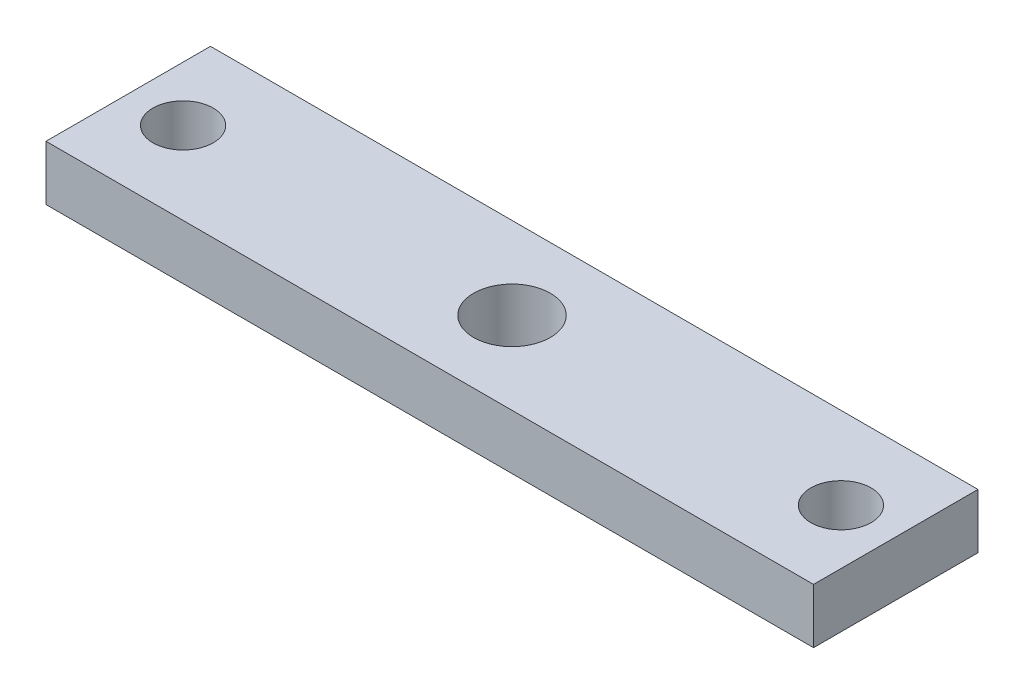
from build123d import *

# Parameters (mm, degrees)
SKETCH1_W           = 140
SKETCH1_H           = 30
BOSS_EXTRUDE1_DEPTH = 10
SKETCH2_R           = 5.5
CUT_EXTRUDE1_DEPTH  = 73.284161474


with BuildPart() as part:
    # Sketch1 → Boss-Extrude1 (new body)
    with BuildSketch(Plane(origin=(0, 0, 0), x_dir=(1, 0, 0), z_dir=(0, 1, 0))):
        Rectangle(SKETCH1_W, SKETCH1_H)
    extrude(amount=BOSS_EXTRUDE1_DEPTH)

    # Sketch2 → Cut-Extrude1 (cut, through all)
    with BuildSketch(Plane(origin=(0, 10, 0), x_dir=(1, 0, 0), z_dir=(0, 1, 0))):
        with Locations(Location((-60, 0, 0), (0, 0, 270))):
            Circle(SKETCH2_R)
        with Locations(Location((60, 0, 0), (0, 0, 270))):
            Circle(SKETCH2_R)
    extrude(amount=-CUT_EXTRUDE1_DEPTH, mode=Mode.SUBTRACT)

    # Sketch4 → M16 Tapped Hole1 (revolve, cut)
    with BuildSketch(Plane(origin=(0, 10, 0), x_dir=(0, 0, 1), z_dir=(1, 0, 0))):
        Polygon((0, 0), (0, 45), (7, 38), (7, 0), align=None)
    revolve(axis=Axis((0, 16.35, 0), (0, -1, 0)), mode=Mode.SUBTRACT)


solid = part.part
